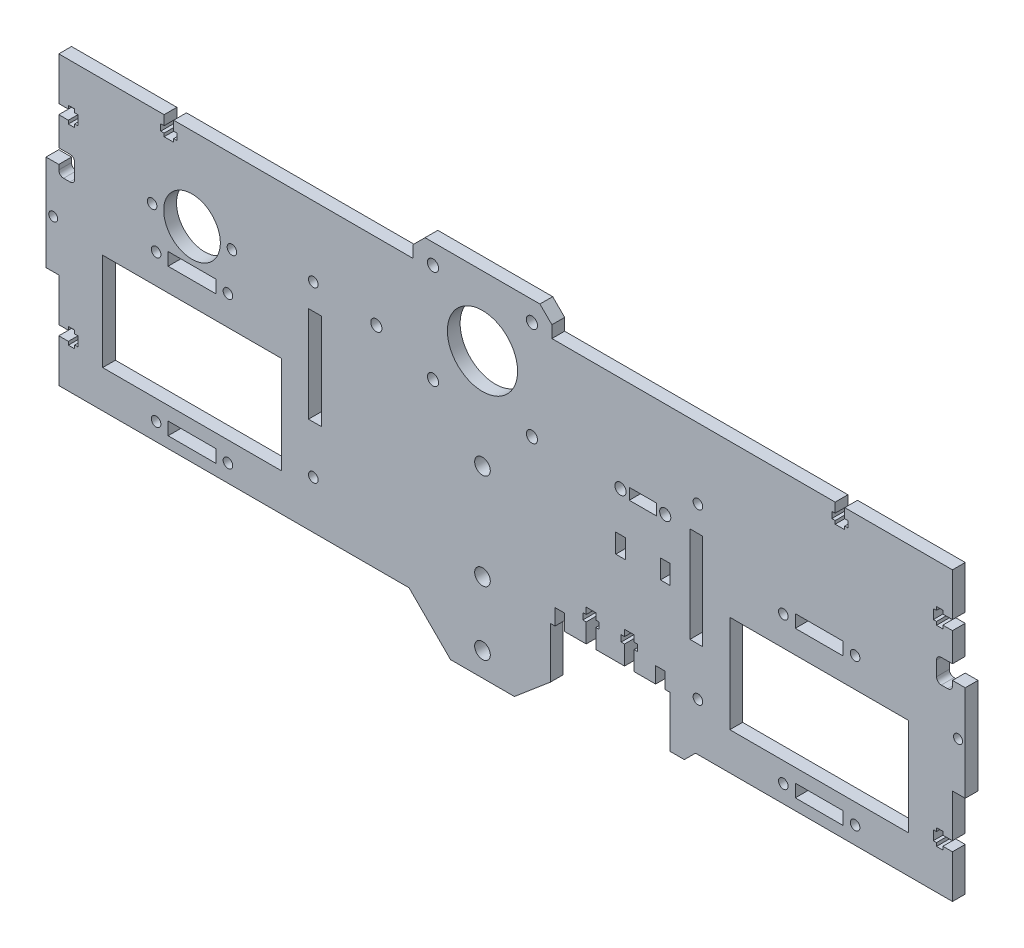
from build123d import *

# Parameters (mm, degrees)
SKETCH_1_R          = 1.5
SKETCH_1_W          = 15
SKETCH_1_H          = 4
SKETCH_1_W_2        = 56
SKETCH_1_H_2        = 30.5
SKETCH_1_R_2        = 1.4
SKETCH_1_R_3        = 8.875
SKETCH_1_R_4        = 1.75
EXTRUDE_1_DEPTH     = 4
SKETCH_2_R          = 1.4
EXTRUDE_2_DEPTH     = 4
SKETCH_3_R          = 1.75
SKETCH_3_R_2        = 11
CUT_EXTRUDE_1_DEPTH = 154.324003339
SKETCH_4_W          = 20
SKETCH_4_H          = 13
SKETCH_4_R          = 2.45
SKETCH_4_W_2        = 4.5
SKETCH_4_H_2        = 3.5
EXTRUDE_3_DEPTH     = 4
SKETCH_5_R          = 2.45
SKETCH_5_R_2        = 1.5
SKETCH_5_W          = 4
SKETCH_5_H          = 30
SKETCH_5_R_3        = 1.75
SKETCH_5_W_2        = 3
SKETCH_5_H_2        = 6
SKETCH_5_W_3        = 8.5
SKETCH_5_H_3        = 3.5
CUT_EXTRUDE_2_DEPTH = 156.293270942
FILLET_1_R          = 1.5


with BuildPart() as part:
    # Эскиз1 → Бобышка-Вытянуть1 (new body)
    with BuildSketch(Plane.XY):
        Polygon((-140, -31.5), (-140, -45), (140, -45), (140, -31.5), (137, -31.5), (137, -32.55), (135, -32.55), (135, -31.5), (134, -31.5), (134, -28.5), (135, -28.5), (135, -27.45), (137, -27.45), (137, -28.5), (140, -28.5), (140, -15), (144, -15), (144, 15), (140, 15), (140, 12), (135, 12), (135, 19.5), (140, 19.5), (140, 28.5), (137, 28.5), (137, 27.45), (135, 27.45), (135, 28.5), (134, 28.5), (134, 31.5), (135, 31.5), (135, 32.55), (137, 32.55), (137, 31.5), (140, 31.5), (140, 45), (106.25, 45), (106.25, 42), (107.3, 42), (107.3, 40), (106.25, 40), (106.25, 39), (103.25, 39), (103.25, 40), (102.2, 40), (102.2, 42), (103.25, 42), (103.25, 45), (14.5, 45), (14.5, 48.75), (10.75, 52.5), (-25.25, 52.5), (-29, 48.75), (-29, 45), (-104, 45), (-104, 42), (-102.95, 42), (-102.95, 40), (-104, 40), (-104, 39), (-107, 39), (-107, 40), (-108.05, 40), (-108.05, 42), (-107, 42), (-107, 45), (-140, 45), (-140, 31.5), (-137, 31.5), (-137, 32.55), (-135, 32.55), (-135, 31.5), (-134, 31.5), (-134, 28.5), (-135, 28.5), (-135, 27.45), (-137, 27.45), (-137, 28.5), (-140, 28.5), (-140, 19.5), (-135, 19.5), (-135, 12), (-140, 12), (-140, 15), (-144, 15), (-144, -15), (-140, -15), (-140, -28.5), (-137, -28.5), (-137, -27.45), (-135, -27.45), (-135, -28.5), (-134, -28.5), (-134, -31.5), (-135, -31.5), (-135, -32.55), (-137, -32.55), (-137, -31.5), align=None)
        with Locations((-109.5, -39.5)):
            Circle(SKETCH_1_R, mode=Mode.SUBTRACT)
        with Locations((-98.25, -39.5)):
            Rectangle(SKETCH_1_W, SKETCH_1_H, mode=Mode.SUBTRACT)
        with Locations((-87, -39.5)):
            Circle(SKETCH_1_R, mode=Mode.SUBTRACT)
        with Locations((-98.25, -18)):
            Rectangle(SKETCH_1_W_2, SKETCH_1_H_2, mode=Mode.SUBTRACT)
        with Locations((87, -39.5)):
            Circle(SKETCH_1_R, mode=Mode.SUBTRACT)
        with Locations((98.25, -39.5)):
            Rectangle(SKETCH_1_W, SKETCH_1_H, mode=Mode.SUBTRACT)
        with Locations((109.5, -39.5)):
            Circle(SKETCH_1_R, mode=Mode.SUBTRACT)
        with Locations((98.25, -18)):
            Rectangle(SKETCH_1_W_2, SKETCH_1_H_2, mode=Mode.SUBTRACT)
        with Locations((-141.75, 0)):
            Circle(SKETCH_1_R_2, mode=Mode.SUBTRACT)
        with Locations((-109.5, 6.5)):
            Circle(SKETCH_1_R, mode=Mode.SUBTRACT)
        with Locations((-98.25, 6.5)):
            Rectangle(SKETCH_1_W, SKETCH_1_H, mode=Mode.SUBTRACT)
        with Locations((-87, 6.5)):
            Circle(SKETCH_1_R, mode=Mode.SUBTRACT)
        with Locations((-110.75, 19)):
            Circle(SKETCH_1_R, mode=Mode.SUBTRACT)
        with Locations((-98.25, 19)):
            Circle(SKETCH_1_R_3, mode=Mode.SUBTRACT)
        with Locations((-85.75, 19)):
            Circle(SKETCH_1_R, mode=Mode.SUBTRACT)
        with Locations((-40.5, 21.1)):
            Circle(SKETCH_1_R_4, mode=Mode.SUBTRACT)
        with Locations((141.75, 0)):
            Circle(SKETCH_1_R_2, mode=Mode.SUBTRACT)
        with Locations((87, 6.5)):
            Circle(SKETCH_1_R, mode=Mode.SUBTRACT)
        with Locations((98.25, 6.5)):
            Rectangle(SKETCH_1_W, SKETCH_1_H, mode=Mode.SUBTRACT)
        with Locations((109.5, 6.5)):
            Circle(SKETCH_1_R, mode=Mode.SUBTRACT)
    extrude(amount=EXTRUDE_1_DEPTH)

    # Эскиз2 → Бобышка-Вытянуть2 (add, through all)
    # profile 1 of 2: a face of its own
    with BuildSketch(Plane.XY.offset(4)):
        Polygon((-144, 15), (-144, -15), (-140, -15), (-140, 12), (-140, 15), align=None)
        with Locations((-141.75, 0)):
            Circle(SKETCH_2_R, mode=Mode.SUBTRACT)
    # profile 2 of 2: a face of its own
    with BuildSketch(Plane.XY.offset(4)):
        Polygon((144, -15), (144, 15), (140, 15), (140, 12), (140, -15), align=None)
        with Locations((141.75, 0)):
            Circle(SKETCH_2_R, mode=Mode.SUBTRACT)
    extrude(amount=-EXTRUDE_2_DEPTH)

    # Эскиз3 → Вырез-Вытянуть1 (cut, through all)
    with BuildSketch(Plane.XY.offset(4)):
        Polygon((14, -32.5), (14, -45), (51.5, -45), (51.5, -32.5), (50, -32.5), (50, -27.5), (47, -27.5), (47, -32.5), (40.25, -32.5), (40.25, -26.5), (41.3, -26.5), (41.3, -24.5), (40.25, -24.5), (40.25, -22.5), (37.25, -22.5), (37.25, -24.5), (36.2, -24.5), (36.2, -26.5), (37.25, -26.5), (37.25, -32.5), (28.25, -32.5), (28.25, -26.5), (29.3, -26.5), (29.3, -24.5), (28.25, -24.5), (28.25, -22.5), (25.25, -22.5), (25.25, -24.5), (24.2, -24.5), (24.2, -26.5), (25.25, -26.5), (25.25, -32.5), (18.5, -32.5), (18.5, -27.5), (15.5, -27.5), (15.5, -32.5), align=None)
        with Locations((8.25, 15.25)):
            Circle(SKETCH_3_R)
        with Locations((-22.75, 15.25)):
            Circle(SKETCH_3_R)
        with Locations((8.25, 46.25)):
            Circle(SKETCH_3_R)
        with Locations((-22.75, 46.25)):
            Circle(SKETCH_3_R)
        with Locations((-7.25, 30.75)):
            Circle(SKETCH_3_R_2)
    extrude(amount=-CUT_EXTRUDE_1_DEPTH, mode=Mode.SUBTRACT)

    # Эскиз4 → Бобышка-Вытянуть3 (add, through all)
    # profile 1 of 6: a face of its own
    with BuildSketch(Plane.XY.offset(4)):
        with Locations((-7.25, -51.5)):
            Rectangle(SKETCH_4_W, SKETCH_4_H)
        with Locations((-7.25, -50.5)):
            Circle(SKETCH_4_R, mode=Mode.SUBTRACT)
    # profile 2 of 6: a face of its own
    with BuildSketch(Plane.XY.offset(4)):
        Polygon((9.5, -45), (2.75, -45), (2.75, -58), (14, -48.5), (9.5, -48.5), align=None)
    # profile 3 of 6: a face of its own
    with BuildSketch(Plane.XY.offset(4)):
        Polygon((-17.25, -58), (-17.25, -45), (-30.25, -45), align=None)
    # profile 4 of 6: a face of its own
    with BuildSketch(Plane.XY.offset(4)):
        with Locations((11.75, -46.75)):
            Rectangle(SKETCH_4_W_2, SKETCH_4_H_2)
    # profile 5 of 6: a face of its own
    with BuildSketch(Plane.XY.offset(4)):
        Polygon((59.5, -45), (56, -45), (56, -48.5), align=None)
    # profile 6 of 6: a face of its own
    with BuildSketch(Plane.XY.offset(4)):
        with Locations((53.75, -46.75)):
            Rectangle(SKETCH_4_W_2, SKETCH_4_H_2)
    extrude(amount=-EXTRUDE_3_DEPTH)

    # Эскиз5 → Вырез-Вытянуть2 (cut, through all)
    with BuildSketch(Plane.XY.offset(4)):
        with Locations((-7.25, -0.5)):
            Circle(SKETCH_5_R)
        with Locations((-7.25, -30.5)):
            Circle(SKETCH_5_R)
        with Locations((-60.25, -30)):
            Circle(SKETCH_5_R_2)
        with Locations((-59.75, 0)):
            Rectangle(SKETCH_5_W, SKETCH_5_H)
        with Locations((-60.25, 23)):
            Circle(SKETCH_5_R_2)
        with Locations((60.25, 23)):
            Circle(SKETCH_5_R_2)
        with Locations((59.75, 0)):
            Rectangle(SKETCH_5_W, SKETCH_5_H)
        with Locations((60.25, -30)):
            Circle(SKETCH_5_R_2)
        with Locations((36, 15)):
            Circle(SKETCH_5_R_3)
        with Locations((50, 15)):
            Circle(SKETCH_5_R_3)
        with Locations((36, -0.5)):
            Rectangle(SKETCH_5_W_2, SKETCH_5_H_2)
        with Locations((43, 15)):
            Rectangle(SKETCH_5_W_3, SKETCH_5_H_3)
        with Locations((50, -0.5)):
            Rectangle(SKETCH_5_W_2, SKETCH_5_H_2)
    extrude(amount=-CUT_EXTRUDE_2_DEPTH, mode=Mode.SUBTRACT)

    # Скругление1
    fillet_1_edges = [part.edges().sort_by_distance(p)[0] for p in [
        (135, 19.5, 2),
        (135, 12, 2),
        (140, 12, 2),
        (-140, 12, 2),
        (-135, 12, 2),
        (-135, 19.5, 2),
    ]]
    fillet(fillet_1_edges, radius=FILLET_1_R)


solid = part.part
